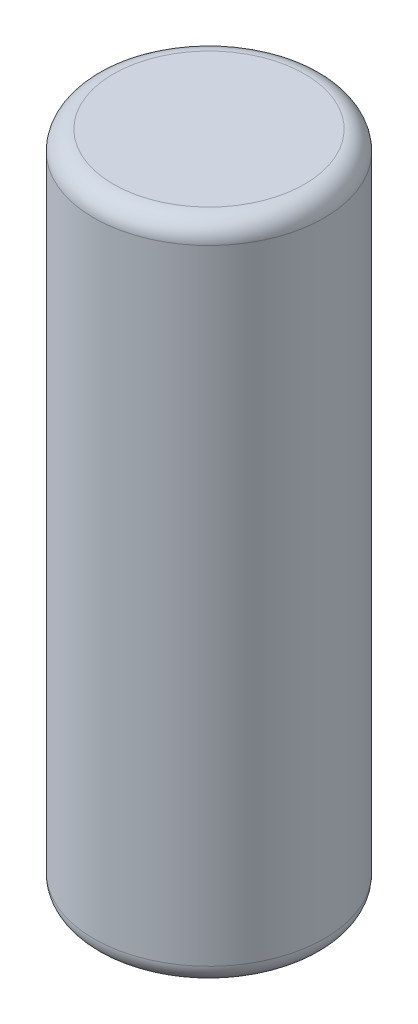
from build123d import *

# Parameters (mm, degrees)
SKETCH1_R           = 2.95
BOSS_EXTRUDE1_DEPTH = 17
FILLET1_R           = 0.5


with BuildPart() as part:
    # Sketch1 → Boss-Extrude1 (new body)
    with BuildSketch(Plane(origin=(0, 0, 0), x_dir=(1, 0, 0), z_dir=(0, 1, 0))):
        with Locations(Location((0, 0, 0), (0, 0, 270))):
            Circle(SKETCH1_R)
    extrude(amount=BOSS_EXTRUDE1_DEPTH)

    # Fillet1
    fillet1_edges = [part.edges().sort_by_distance(p)[0] for p in [
        (0, 0, -2.95),
        (0, 17, -2.95),
    ]]
    fillet(fillet1_edges, radius=FILLET1_R)


solid = part.part
